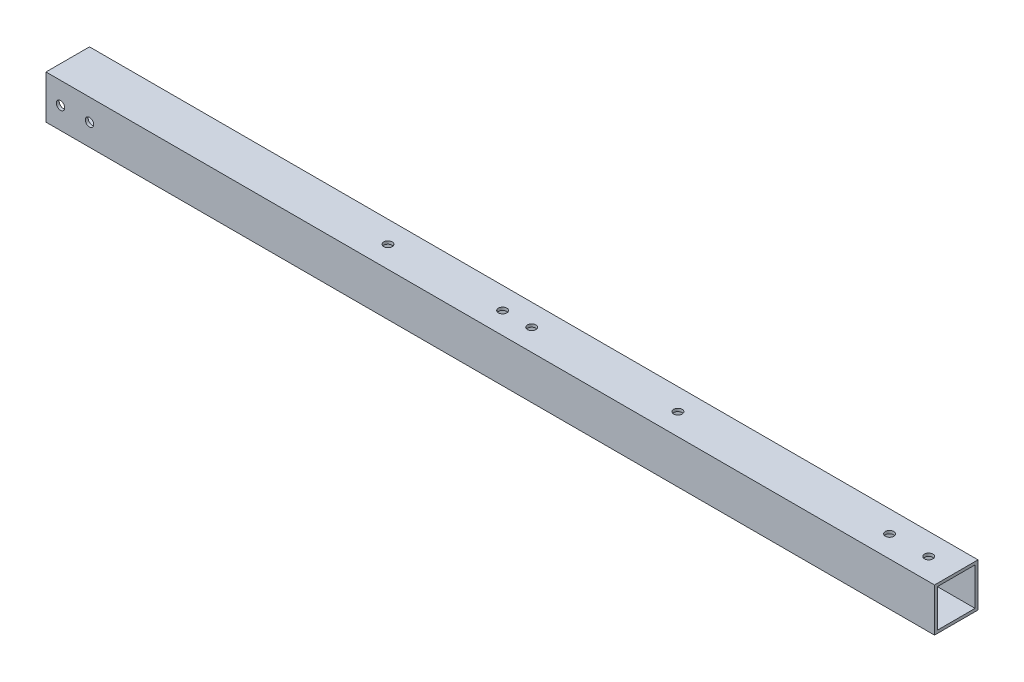
from build123d import *

# Parameters (mm, degrees)
SKETCH_1_W          = 15
SKETCH_1_H          = 15
SKETCH_1_W_2        = 13
SKETCH_1_H_2        = 13
EXTRUDE_1_DEPTH     = 306.44
SKETCH_2_R          = 1.45
CUT_EXTRUDE_1_DEPTH = 307.898555878
SKETCH_3_R          = 1.45
CUT_EXTRUDE_2_DEPTH = 307.898555878


with BuildPart() as part:
    # 草图1 → 凸台-拉伸1 (new body)
    with BuildSketch(Plane(origin=(0, 0, 0), x_dir=(0, 0, -1), z_dir=(1, 0, 0))):
        Rectangle(SKETCH_1_W, SKETCH_1_H)
        Rectangle(SKETCH_1_W_2, SKETCH_1_H_2, mode=Mode.SUBTRACT)
    extrude(amount=EXTRUDE_1_DEPTH)

    # 草图2 → 切除-拉伸1 (cut, through all)
    with BuildSketch(Plane.XZ.offset(7.5)):
        with Locations(Location((110.44, 0, 0), (0, 0, 270))):
            Circle(SKETCH_2_R)
        with Locations(Location((210.44, 0, 0), (0, 0, 270))):
            Circle(SKETCH_2_R)
        with Locations(Location((283.44, 0, 0), (0, 0, 270))):
            Circle(SKETCH_2_R)
        with Locations(Location((296.94, 0, 0), (0, 0, 270))):
            Circle(SKETCH_2_R)
        with Locations(Location((150, 0, 0), (0, 0, 270))):
            Circle(SKETCH_2_R)
        with Locations(Location((160, 0, 0), (0, 0, 270))):
            Circle(SKETCH_2_R)
    extrude(amount=-CUT_EXTRUDE_1_DEPTH, mode=Mode.SUBTRACT)

    # 草图3 → 切除-拉伸2 (cut, through all)
    with BuildSketch(Plane(origin=(0, 0, -7.5), x_dir=(-1, 0, 0), z_dir=(0, 0, -1))):
        with Locations((-5, 0)):
            Circle(SKETCH_3_R)
        with Locations((-15, 0)):
            Circle(SKETCH_3_R)
    extrude(amount=-CUT_EXTRUDE_2_DEPTH, mode=Mode.SUBTRACT)


solid = part.part
